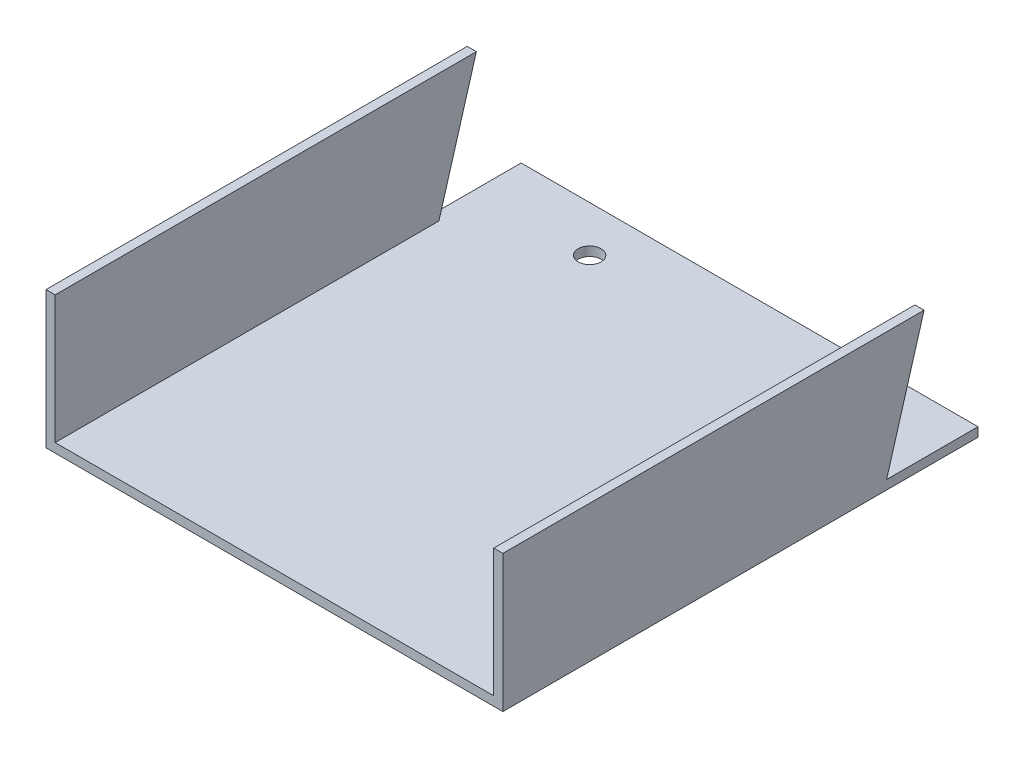
from build123d import *

# Parameters (mm, degrees)
SKETCH1_W           = 127
SKETCH1_H           = 38.1
BOSS_EXTRUDE1_DEPTH = 132.08
CUT_EXTRUDE1_DEPTH  = 35.56
BOSS_EXTRUDE2_DEPTH = 2.54
BOSS_EXTRUDE3_START = 127
BOSS_EXTRUDE3_DEPTH = 2.54
SKETCH4_R           = 3.175
CUT_EXTRUDE2_DEPTH  = 2.54


with BuildPart() as part:
    # Sketch1 → Boss-Extrude1 (new body)
    with BuildSketch(Plane.XY):
        with Locations((63.5, 19.05)):
            Rectangle(SKETCH1_W, SKETCH1_H)
    extrude(amount=BOSS_EXTRUDE1_DEPTH)

    # Sketch2 → Cut-Extrude1 (cut)
    with BuildSketch(Plane(origin=(0, 38.1, 0), x_dir=(1, 0, 0), z_dir=(0, 1, 0))):
        Polygon((0, -25.4), (2.54, -25.4), (2.54, -132.08), (124.46, -132.08), (124.46, -25.4), (127, -25.4), (127, 0), (0, 0), align=None)
    extrude(amount=-CUT_EXTRUDE1_DEPTH, mode=Mode.SUBTRACT)

    # Sketch3 → Boss-Extrude2 (add)
    with BuildSketch(Plane(origin=(0, 0, 0), x_dir=(0, 0, -1), z_dir=(1, 0, 0))):
        Polygon((-25.4, 2.54), (-14.986, 38.1), (-25.4, 38.1), align=None)
    extrude(amount=BOSS_EXTRUDE2_DEPTH)

    # Sketch3<2> → Boss-Extrude3 (add)
    with BuildSketch(Plane(origin=(0, 0, 0), x_dir=(0, 0, -1), z_dir=(1, 0, 0)).offset(BOSS_EXTRUDE3_START)):
        Polygon((-25.4, 2.54), (-14.986, 38.1), (-25.4, 38.1), align=None)
    extrude(amount=-BOSS_EXTRUDE3_DEPTH)

    # Sketch4 → Cut-Extrude2 (cut)
    with BuildSketch(Plane(origin=(0, 2.54, 0), x_dir=(1, 0, 0), z_dir=(0, 1, 0))):
        with Locations(Location((31.75, -12.7, 0), (0, 0, 180))):
            Circle(SKETCH4_R)
        with Locations(Location((95.25, -12.7, 0), (0, 0, 180))):
            Circle(SKETCH4_R)
    extrude(amount=-CUT_EXTRUDE2_DEPTH, mode=Mode.SUBTRACT)


solid = part.part
